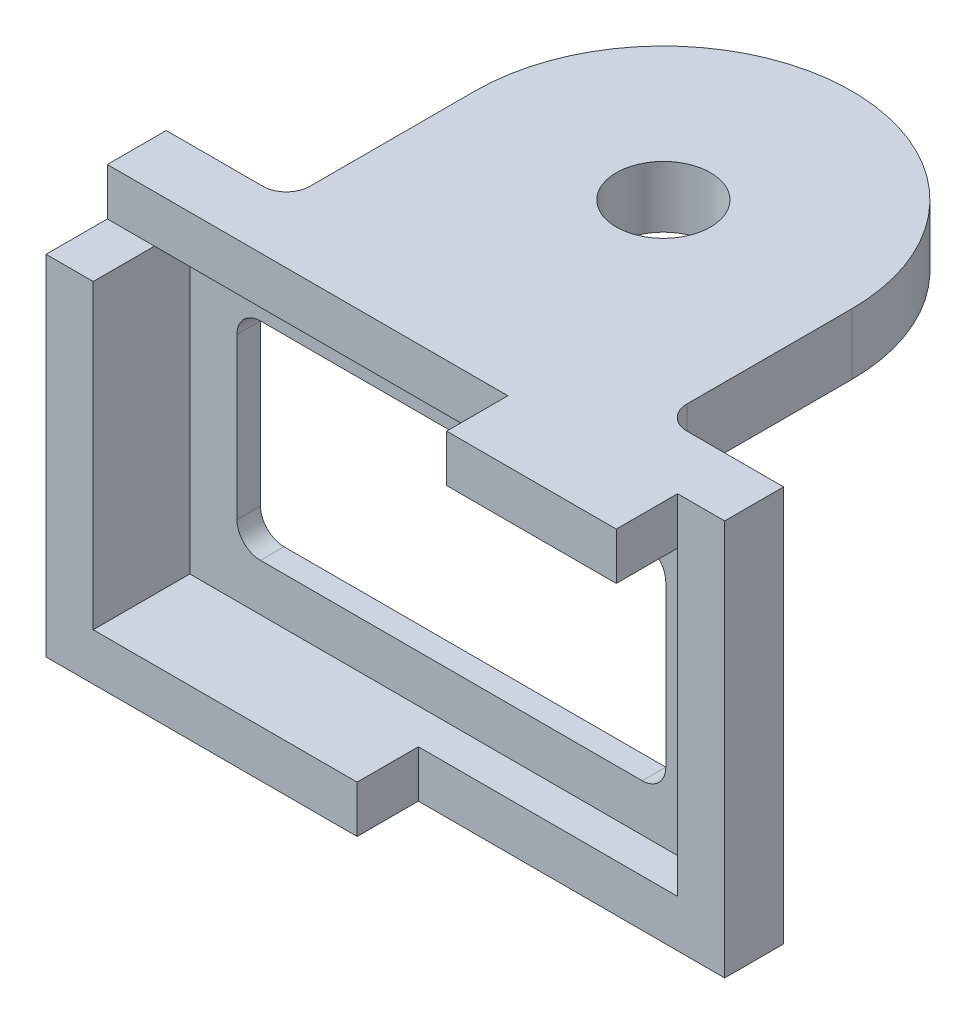
from build123d import *

# Parameters (mm, degrees)
SKETCH1_W           = 28.194
SKETCH1_H           = 2.54
BOSS_EXTRUDE1_DEPTH = 6.477
SKETCH2_W           = 28.194
SKETCH2_H           = 16.256
SKETCH2_W_2         = 23.114
SKETCH2_H_2         = 11.176
BOSS_EXTRUDE2_DEPTH = 1.27
SKETCH3_W           = 21.59
SKETCH3_H           = 2.54
SKETCH3_W_2         = 2.54
SKETCH3_H_2         = 18.796
SKETCH3_W_3         = 13.97
CUT_EXTRUDE1_DEPTH  = 3.302
SKETCH4_R           = 2.54
BOSS_EXTRUDE3_DEPTH = 3.302
FILLET4_R           = 1.27


with BuildPart() as part:
    # Sketch1 → Boss-Extrude1 (new body)
    with BuildSketch(Plane.XY):
        with Locations((-4.067663462, 13.041923077)):
            Rectangle(SKETCH1_W, SKETCH1_H)
        Polygon((-18.164663462, 14.311923077), (-20.704663462, 14.311923077), (-20.704663462, -7.024076923), (12.569336538, -7.024076923), (12.569336538, 14.311923077), (10.029336538, 14.311923077), (10.029336538, 11.771923077), (10.029336538, -4.484076923), (-18.164663462, -4.484076923), (-18.164663462, 11.771923077), align=None)
    extrude(amount=BOSS_EXTRUDE1_DEPTH)

    # Sketch2 → Boss-Extrude2 (add)
    with BuildSketch(Plane(origin=(0, 0, 0), x_dir=(-1, 0, 0), z_dir=(0, 0, -1))):
        with Locations((4.067663462, 3.643923077)):
            Rectangle(SKETCH2_W, SKETCH2_H)
        with Locations((4.067663462, 3.643923077)):
            Rectangle(SKETCH2_W_2, SKETCH2_H_2, mode=Mode.SUBTRACT)
    extrude(amount=-BOSS_EXTRUDE2_DEPTH)

    # Sketch3 → Cut-Extrude1 (cut)
    with BuildSketch(Plane.XY.offset(6.477)):
        with Locations((-9.909663462, 13.041923077)):
            Rectangle(SKETCH3_W, SKETCH3_H)
        with Locations((11.299336538, 4.913923077)):
            Rectangle(SKETCH3_W_2, SKETCH3_H_2)
        with Locations((11.299336538, -5.754076923)):
            Rectangle(SKETCH3_W_2, SKETCH3_H)
        with Locations((3.044336538, -5.754076923)):
            Rectangle(SKETCH3_W_3, SKETCH3_H)
    extrude(amount=-CUT_EXTRUDE1_DEPTH, mode=Mode.SUBTRACT)

    # Sketch4 → Boss-Extrude3 (add)
    with BuildSketch(Plane(origin=(0, 14.311923077, 0), x_dir=(1, 0, 0), z_dir=(0, 1, 0))):
        with BuildLine():
            Line((-14.227663462, 10.16), (-14.227663462, 0))
            Line((-14.227663462, 0), (6.092336538, 0))
            Line((6.092336538, 0), (6.092336538, 10.16))
            ThreePointArc((6.092336538, 10.16), (-4.067663462, 20.32), (-14.227663462, 10.16))
        make_face()
        with Locations(Location((-4.067663462, 10.16, 0), (0, 0, 270))):
            Circle(SKETCH4_R, mode=Mode.SUBTRACT)
    extrude(amount=-BOSS_EXTRUDE3_DEPTH)

    # Fillet4
    fillet4_edges = [part.edges().sort_by_distance(p)[0] for p in [
        (-4.067663462, 11.009923077, 0),
        (6.092336538, 12.660923077, 0),
        (-14.227663462, 12.660923077, 0),
        (-15.624663462, 9.231923077, 0.635),
        (-15.624663462, -1.944076923, 0.635),
        (7.489336538, -1.944076923, 0.635),
        (7.489336538, 9.231923077, 0.635),
    ]]
    fillet(fillet4_edges, radius=FILLET4_R)


solid = part.part
